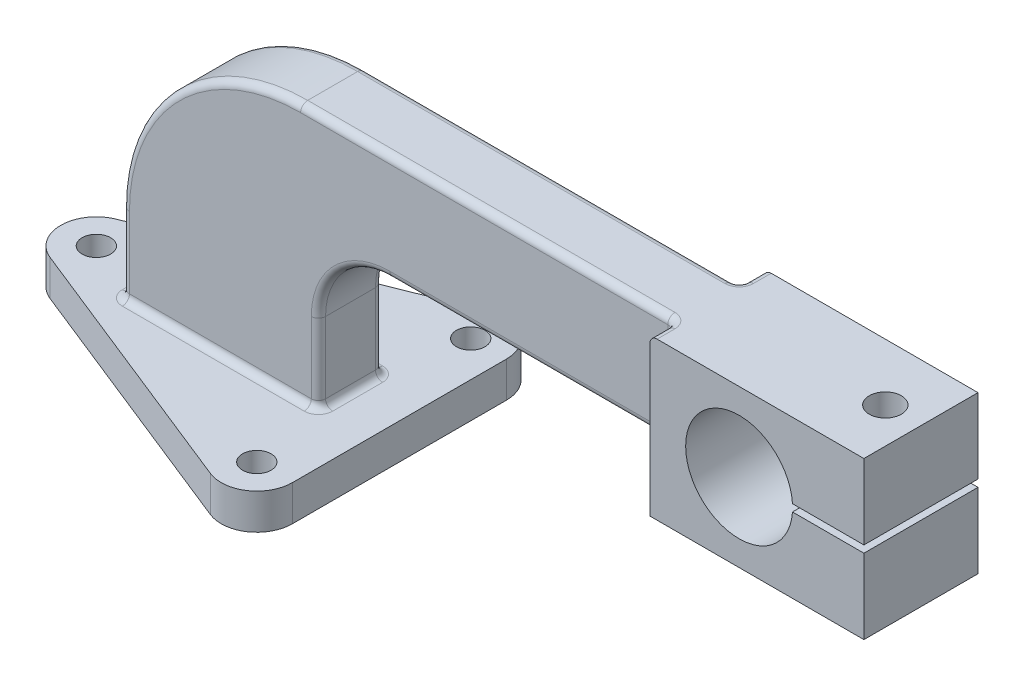
from build123d import *

# Parameters (mm, degrees)
SKETCH1_R           = 4
BOSS_EXTRUDE1_DEPTH = 10
BOSS_EXTRUDE2_DEPTH = 9
BOSS_EXTRUDE3_DEPTH = 16
SKETCH3_R           = 4.5
CUT_EXTRUDE1_DEPTH  = 274.856521232
FILLET5_R           = 2


with BuildPart() as part:
    # Sketch1 → Boss-Extrude1 (new body)
    with BuildSketch(Plane(origin=(0, 0, 0), x_dir=(1, 0, 0), z_dir=(0, 1, 0))):
        with BuildLine():
            Line((23.211917272, 9.284766909), (98.211917272, 39.284766909))
            ThreePointArc((98.211917272, 39.284766909), (107.532112129, 38.280672305), (111.925824036, 30))
            Line((111.925824036, 30), (111.925824036, -30))
            ThreePointArc((111.925824036, -30), (107.532112129, -38.280672305), (98.211917272, -39.284766909))
            Line((98.211917272, -39.284766909), (23.211917272, -9.284766909))
            ThreePointArc((23.211917272, -9.284766909), (16.925824036, 0), (23.211917272, 9.284766909))
        make_face()
        with Locations((26.925824036, 0)):
            Circle(SKETCH1_R, mode=Mode.SUBTRACT)
        with Locations((101.925824036, 30)):
            Circle(SKETCH1_R, mode=Mode.SUBTRACT)
        with Locations((101.925824036, -30)):
            Circle(SKETCH1_R, mode=Mode.SUBTRACT)
    extrude(amount=BOSS_EXTRUDE1_DEPTH)

    # Sketch2 → Boss-Extrude2 (add, symmetric)
    with BuildSketch(Plane.XY):
        with BuildLine():
            Line((43.211917272, 32), (43.211917272, 10))
            Line((43.211917272, 10), (98.211917272, 10))
            Line((98.211917272, 10), (98.211917272, 32))
            ThreePointArc((98.211917272, 32), (104.069781648, 46.142135624), (118.211917272, 52))
            Line((118.211917272, 52), (198.211917272, 52))
            Line((198.211917272, 52), (198.211917272, 82))
            Line((198.211917272, 82), (93.211917272, 82))
            ThreePointArc((93.211917272, 82), (57.856578213, 67.355339059), (43.211917272, 32))
        make_face()
    extrude(amount=BOSS_EXTRUDE2_DEPTH, both=True)

    # Sketch2<4> → Boss-Extrude3 (add, symmetric)
    with BuildSketch(Plane.XY):
        with BuildLine():
            Line((258.211917272, 82), (198.211917272, 82))
            Line((198.211917272, 82), (198.211917272, 52))
            Line((198.211917272, 52), (198.211917272, 38))
            Line((198.211917272, 38), (258.211917272, 38))
            Line((258.211917272, 38), (258.211917272, 59))
            Line((258.211917272, 59), (238.178546819, 59))
            ThreePointArc((238.178546819, 59), (208.211917272, 60), (238.178546819, 61))
            Line((238.178546819, 61), (258.211917272, 61))
            Line((258.211917272, 61), (258.211917272, 82))
        make_face()
    extrude(amount=BOSS_EXTRUDE3_DEPTH, both=True)

    # Sketch3 → Cut-Extrude1 (cut, through all)
    with BuildSketch(Plane(origin=(0, 82, 0), x_dir=(1, 0, 0), z_dir=(0, 1, 0))):
        with Locations((248.211917272, 0)):
            Circle(SKETCH3_R)
    extrude(amount=-CUT_EXTRUDE1_DEPTH, mode=Mode.SUBTRACT)

    # Fillet5
    fillet5_edges = [part.edges().sort_by_distance(p)[0] for p in [
        (198.211917272, 82, 12.5),
        (198.211917272, 52, 0),
        (198.211917272, 82, -12.5),
        (43.211917272, 10, 0),
        (98.211917272, 10, 0),
        (70.711917272, 10, 9),
        (43.211917272, 21, 9),
        (57.856578213, 67.355339059, 9),
        (145.711917272, 82, 9),
        (198.211917272, 67, 9),
        (158.211917272, 52, 9),
        (104.069781648, 46.142135624, 9),
        (98.211917272, 21, 9),
        (104.069781648, 46.142135624, -9),
        (158.211917272, 52, -9),
        (198.211917272, 67, -9),
        (145.711917272, 82, -9),
        (57.856578213, 67.355339059, -9),
        (43.211917272, 21, -9),
        (70.711917272, 10, -9),
        (98.211917272, 21, -9),
    ]]
    fillet(fillet5_edges, radius=FILLET5_R)


solid = part.part
